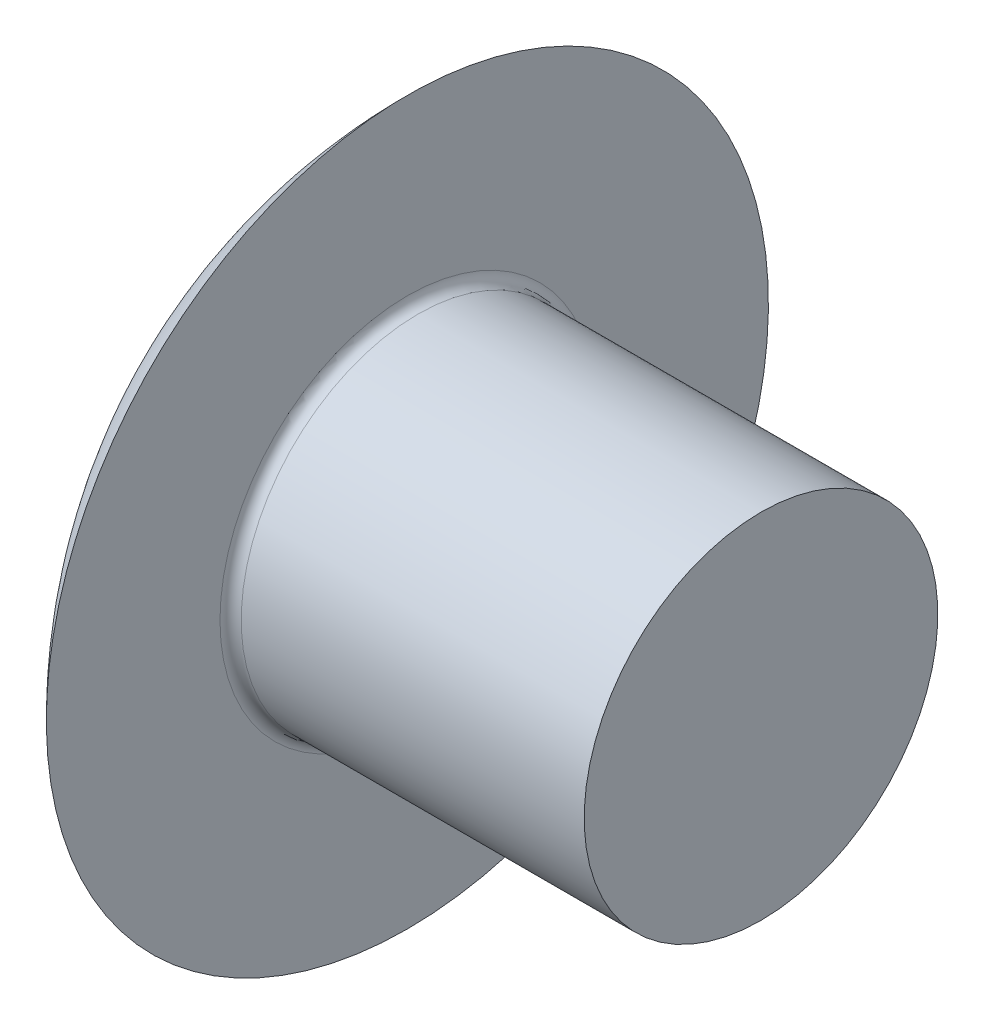
from build123d import *


with BuildPart() as part:
    # 草图1 → 旋转1 (revolve)
    with BuildSketch(Plane.XY, mode=Mode.PRIVATE) as revolve_1_sk:
        with BuildLine():
            Line((4.24, 10.21), (4.24, 5.3))
            ThreePointArc((4.24, 5.3), (4.327867966, 5.087867966), (4.54, 5))
            Line((4.54, 5), (14.24, 5))
            Line((14.24, 5), (14.24, 0))
            Line((14.24, 0), (0, 0))
            ThreePointArc((0, 0), (1.108752259, 5.52495009), (4.24, 10.21))
        make_face()
    revolve(revolve_1_sk.sketch.rotate(Axis((0, 0, 0), (1, 0, 0)), 180), axis=Axis((0, 0, 0), (1, 0, 0)))


solid = part.part
